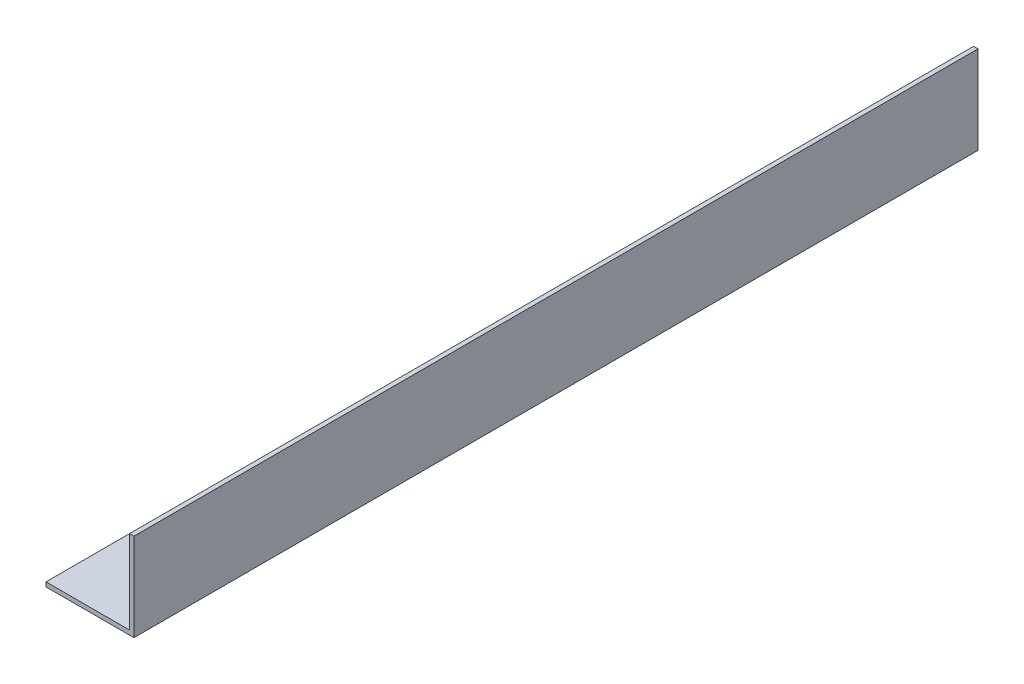
from build123d import *

# Parameters (mm, degrees)
BOSS_EXTRUDE1_DEPTH = 152.4


with BuildPart() as part:
    # Sketch2 → Boss-Extrude1 (new, symmetric)
    with BuildSketch(Plane.XY):
        with BuildLine():
            Line((-15.875, 0), (15.875, 0))
            Line((15.875, 0), (15.875, 31.75))
            Line((15.875, 31.75), (14.2875, 31.75))
            Line((14.2875, 31.75), (14.2875, 1.9685))
            ThreePointArc((14.2875, 1.9685), (14.175907684, 1.699092316), (13.9065, 1.5875))
            Line((13.9065, 1.5875), (-15.875, 1.5875))
            Line((-15.875, 1.5875), (-15.875, 0))
        make_face()
    extrude(amount=BOSS_EXTRUDE1_DEPTH, both=True)


solid = part.part
